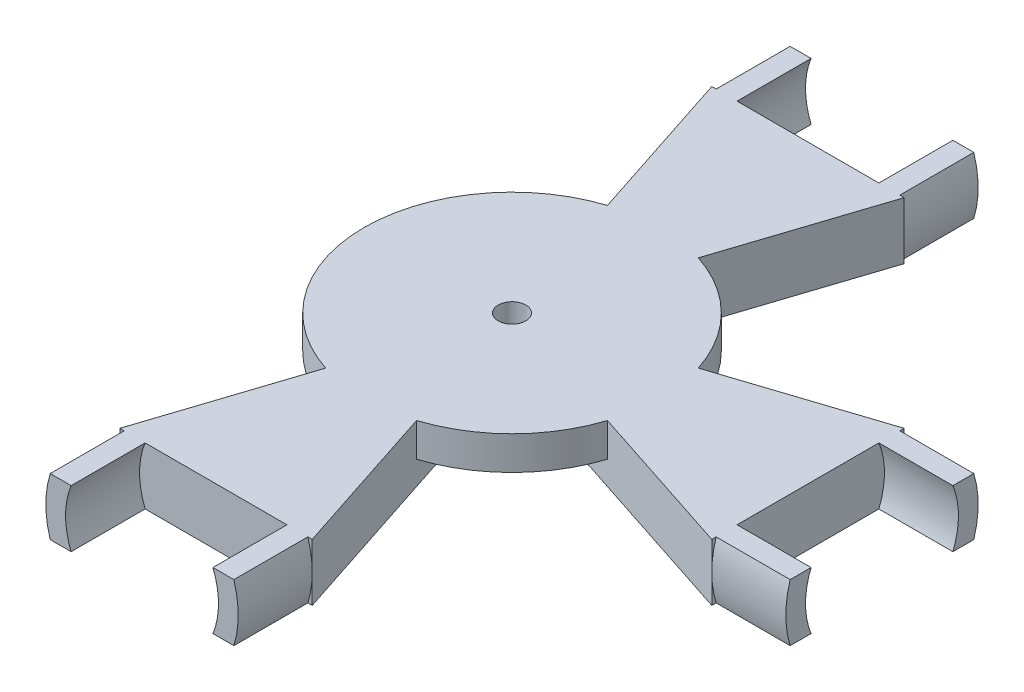
from build123d import *

# Parameters (mm, degrees)
SKETCH1_R                 = 6.35
BOSS_EXTRUDE1_DEPTH       = 5.4
HORN_START                = -2.5
HORN_DEPTH                = 2.5
SKETCH4_R                 = 1.4
CUT_EXTRUDE1_DEPTH        = 21.913032
SKETCH5_R                 = 0.5
CUT_EXTRUDE2_DEPTH        = 21.913032
LPATTERN1_COUNT           = 4
LPATTERN1_PITCH           = 3
MIRROR1_COPY_1_SKETCH_R   = 0.5
MIRROR1_COPY_1_DEPTH      = 21.913032
MIRROR1_COPY_2_SKETCH_R   = 0.5
MIRROR1_COPY_2_DEPTH      = 21.913032
MIRROR1_COPY_3_SKETCH_R   = 0.5
MIRROR1_COPY_3_DEPTH      = 21.913032
CUT_EXTRUDE4_DEPTH        = 3
CIRPATTERN2_COUNT         = 26
SKETCH9_R                 = 2.6
CUT_EXTRUDE5_DEPTH        = 3
SKETCH10_R                = 6.35
SKETCH10_R_2              = 4.25
CUT_EXTRUDE6_DEPTH        = 2.9
BOSS_EXTRUDE5_DEPTH       = 0.5
CIRPATTERN3_COUNT         = 4
SKETCH12_R                = 4.375
CUT_EXTRUDE7_DEPTH        = 1
SKETCH13_R                = 3.375
SKETCH13_R_2              = 2.875
BOSS_EXTRUDE6_DEPTH       = 1
SKETCH14_R                = 3.375
SKETCH14_R_2              = 2.875
BOSS_EXTRUDE7_DEPTH       = 0.35
BOSS_EXTRUDE8_DEPTH       = 7.5
BOSS_EXTRUDE8_2_DEPTH     = 7.5
BOSS_EXTRUDE9_DEPTH       = 2.9
BOSS_EXTRUDE9_DEPTH_BACK  = 2.9
BOSS_EXTRUDE10_START      = 7.5
BOSS_EXTRUDE10_DEPTH      = 7.5
BOSS_EXTRUDE11_DEPTH      = 7.5
BOSS_EXTRUDE12_DEPTH      = 0.4
BOSS_EXTRUDE12_DEPTH_BACK = 3
SKETCH22_R                = 15
SKETCH22_R_2              = 4.375
SKETCH23_R                = 5.25
SKETCH23_R_2              = 4.25
BOSS_EXTRUDE13_DEPTH      = 2.4
BOSS_EXTRUDE14_START      = 1.4
SKETCH24_R                = 7.155561
SKETCH24_R_2              = 1.4
BOSS_EXTRUDE14_DEPTH      = 1.4


with BuildPart() as part:
    # Sketch1 → Boss-Extrude1 (new body)
    with BuildSketch(Plane(origin=(0, 0, 0), x_dir=(1, 0, 0), z_dir=(0, 1, 0))):
        with Locations(Location((0, 0, 0), (0, 0, 90))):
            Circle(SKETCH1_R)
    extrude(amount=BOSS_EXTRUDE1_DEPTH)

    # Sketch2 → horn (add)
    with BuildSketch(Plane(origin=(0, 5.4, 0), x_dir=(1, 0, 0), z_dir=(0, 1, 0)).offset(HORN_START)):
        with BuildLine():
            Line((-2.609741, 16.990168), (-4.891613, 4.049028))
            ThreePointArc((-4.891613, 4.049028), (0, 6.35), (4.891613, 4.049028))
            Line((4.891613, 4.049028), (2.609741, 16.990168))
            ThreePointArc((2.609741, 16.990168), (0, 19.18), (-2.609741, 16.990168))
        make_face()
    horn = extrude(amount=HORN_DEPTH)

    # Sketch4 → Cut-Extrude1 (cut, through all)
    with BuildSketch(Plane(origin=(0, 5.4, 0), x_dir=(-1, 0, 0), z_dir=(0, -1, 0))):
        with Locations(Location((0, 0, 0), (0, 0, 270))):
            Circle(SKETCH4_R)
    extrude(amount=CUT_EXTRUDE1_DEPTH, mode=Mode.SUBTRACT)

    # Sketch5 → Cut-Extrude2 (cut, through all)
    with BuildSketch(Plane(origin=(0, 0, 0), x_dir=(-1, 0, 0), z_dir=(0, -1, 0))):
        with Locations(Location((0, 16.53, 0), (0, 0, 90))):
            Circle(SKETCH5_R)
    cut_extrude2 = extrude(amount=-CUT_EXTRUDE2_DEPTH, mode=Mode.SUBTRACT)

    # LPattern1: Cut-Extrude2 ×4
    with Locations(*[(0, 0, i * LPATTERN1_PITCH) for i in range(1, LPATTERN1_COUNT)]):
        add(cut_extrude2, mode=Mode.SUBTRACT)

    # Mirror1: horn, Cut-Extrude2 across plane
    add(horn.mirror(Plane.XY))
    add(cut_extrude2.mirror(Plane.XY), mode=Mode.SUBTRACT)

    # Mirror1 copy 1 sketch → Mirror1 copy 1 (cut, through all)
    with BuildSketch(Plane(origin=(0, 0, -3), x_dir=(-1, 0, 0), z_dir=(0, -1, 0))):
        with Locations((0, -16.53)):
            Circle(MIRROR1_COPY_1_SKETCH_R)
    extrude(amount=-MIRROR1_COPY_1_DEPTH, mode=Mode.SUBTRACT)

    # Mirror1 copy 2 sketch → Mirror1 copy 2 (cut, through all)
    with BuildSketch(Plane(origin=(0, 0, -6), x_dir=(-1, 0, 0), z_dir=(0, -1, 0))):
        with Locations((0, -16.53)):
            Circle(MIRROR1_COPY_2_SKETCH_R)
    extrude(amount=-MIRROR1_COPY_2_DEPTH, mode=Mode.SUBTRACT)

    # Mirror1 copy 3 sketch → Mirror1 copy 3 (cut, through all)
    with BuildSketch(Plane(origin=(0, 0, -9), x_dir=(-1, 0, 0), z_dir=(0, -1, 0))):
        with Locations((0, -16.53)):
            Circle(MIRROR1_COPY_3_SKETCH_R)
    extrude(amount=-MIRROR1_COPY_3_DEPTH, mode=Mode.SUBTRACT)

    # Sketch8 → Cut-Extrude4 (cut)
    with BuildSketch(Plane(origin=(0, 0, 0), x_dir=(-1, 0, 0), z_dir=(0, -1, 0))):
        with BuildLine():
            Line((0, -2.9), (0.262913, -2.586673))
            ThreePointArc((0.262913, -2.586673), (0, -2.6), (-0.262913, -2.586673))
            Line((-0.262913, -2.586673), (0, -2.9))
        make_face()
    cut_extrude4 = extrude(amount=-CUT_EXTRUDE4_DEPTH, mode=Mode.SUBTRACT)

    # CirPattern2: Cut-Extrude4 ×26 about axis
    cirpattern2_axis = Axis((0, 0, 0), (0, 1, 0))
    for i in range(1, CIRPATTERN2_COUNT):
        add(cut_extrude4.rotate(cirpattern2_axis, i * 360 / CIRPATTERN2_COUNT), mode=Mode.SUBTRACT)

    # Sketch9 → Cut-Extrude5 (cut)
    with BuildSketch(Plane(origin=(0, 0, 0), x_dir=(-1, 0, 0), z_dir=(0, -1, 0))):
        Circle(SKETCH9_R)
    extrude(amount=-CUT_EXTRUDE5_DEPTH, mode=Mode.SUBTRACT)

    # Sketch10 → Cut-Extrude6 (cut)
    with BuildSketch(Plane(origin=(0, 0, 0), x_dir=(-1, 0, 0), z_dir=(0, -1, 0))):
        Circle(SKETCH10_R)
        with Locations(Location((0, 0, 0), (0, 0, 90))):
            Circle(SKETCH10_R_2, mode=Mode.SUBTRACT)
    extrude(amount=-CUT_EXTRUDE6_DEPTH, mode=Mode.SUBTRACT)

    # Sketch11 → Boss-Extrude5 (add, symmetric)
    with BuildSketch(Plane.XY):
        Polygon((4.21, 0.99), (5.81268, 2.9), (4.21, 2.9), (4.16, 2.9), (4.16, 0.99), align=None)
    boss_extrude5 = extrude(amount=BOSS_EXTRUDE5_DEPTH, both=True)

    # CirPattern3: Boss-Extrude5 ×4 about axis
    cirpattern3_axis = Axis((0, 0, 0), (0, 1, 0))
    for i in range(1, CIRPATTERN3_COUNT):
        add(boss_extrude5.rotate(cirpattern3_axis, i * 360 / CIRPATTERN3_COUNT))

    # Sketch12 → Cut-Extrude7 (cut)
    with BuildSketch(Plane(origin=(0, 5.4, 0), x_dir=(1, 0, 0), z_dir=(0, 1, 0))):
        with Locations(Location((0, 0, 0), (0, 0, 270))):
            Circle(SKETCH12_R)
    extrude(amount=-CUT_EXTRUDE7_DEPTH, mode=Mode.SUBTRACT)

    # Sketch13 → Boss-Extrude6 (add)
    with BuildSketch(Plane(origin=(0, 4.4, 0), x_dir=(1, 0, 0), z_dir=(0, 1, 0))):
        with Locations(Location((0, 0, 0), (0, 0, 270))):
            Circle(SKETCH13_R)
        with Locations(Location((0, 0, 0), (0, 0, 270))):
            Circle(SKETCH13_R_2, mode=Mode.SUBTRACT)
    extrude(amount=BOSS_EXTRUDE6_DEPTH)

    # Sketch14 → Boss-Extrude7 (add)
    with BuildSketch(Plane(origin=(0, 5.4, 0), x_dir=(1, 0, 0), z_dir=(0, 1, 0))):
        with Locations(Location((0, 0, 0), (0, 0, 270))):
            Circle(SKETCH14_R)
        with Locations(Location((0, 0, 0), (0, 0, 270))):
            Circle(SKETCH14_R_2, mode=Mode.SUBTRACT)
    extrude(amount=BOSS_EXTRUDE7_DEPTH)



with BuildPart() as body_2:
    # Sketch16 → Boss-Extrude8 (new body)
    with BuildSketch(Plane.XY.offset(30)):
        with BuildLine():
            Line((-7.186967, 0), (-9.308732, 0))
            ThreePointArc((-9.308732, 0), (-9.75, 2.9), (-9.308732, 5.8))
            Line((-9.308732, 5.8), (-7.186967, 5.8))
            ThreePointArc((-7.186967, 5.8), (-7.75, 2.9), (-7.186967, 0))
        make_face()
    extrude(amount=BOSS_EXTRUDE8_DEPTH)


with BuildPart() as body_3:
    # Sketch16 → Boss-Extrude8 2 (new body)
    with BuildSketch(Plane.XY.offset(30)):
        with BuildLine():
            Line((7.186967, 0), (9.308732, 0))
            ThreePointArc((9.308732, 0), (9.75, 2.9), (9.308732, 5.8))
            Line((9.308732, 5.8), (7.186967, 5.8))
            ThreePointArc((7.186967, 5.8), (7.75, 2.9), (7.186967, 0))
        make_face()
    extrude(amount=BOSS_EXTRUDE8_2_DEPTH)


with BuildPart() as part_1:
    add(part.part)

    add(body_2.part)  # Boss-Extrude9 merges body 2

    add(body_3.part)  # Boss-Extrude9 merges body 3
    # Sketch18 → Boss-Extrude9 (add, two sides: drawn at the far end of the back side and taken through both)
    with BuildSketch(Plane.XZ.offset(-2.9).offset(-BOSS_EXTRUDE9_DEPTH_BACK)):
        with BuildLine():
            Line((-1.259498, 4.059084), (-9.75, 30))
            Line((-9.75, 30), (9.75, 30))
            Line((9.75, 30), (1.259498, 4.059084))
            ThreePointArc((1.259498, 4.059084), (0, 4.25), (-1.259498, 4.059084))
        make_face()
        with BuildLine():
            Line((4.059084, 1.259498), (30, 9.75))
            Line((30, 9.75), (30, -9.75))
            Line((30, -9.75), (4.059084, -1.259498))
            ThreePointArc((4.059084, -1.259498), (4.25, 0), (4.059084, 1.259498))
        make_face()
        with BuildLine():
            Line((1.259498, -4.059084), (9.75, -30))
            Line((9.75, -30), (-9.75, -30))
            Line((-9.75, -30), (-1.259498, -4.059084))
            ThreePointArc((-1.259498, -4.059084), (0, -4.25), (1.259498, -4.059084))
        make_face()
    extrude(amount=BOSS_EXTRUDE9_DEPTH + BOSS_EXTRUDE9_DEPTH_BACK)

    # Sketch19 → Boss-Extrude10 (add)
    with BuildSketch(Plane(origin=(0, 0, -30), x_dir=(-1, 0, 0), z_dir=(0, 0, -1)).offset(BOSS_EXTRUDE10_START)):
        with BuildLine():
            Line((-9.308732, 5.8), (-7.186967, 5.8))
            ThreePointArc((-7.186967, 5.8), (-7.75, 2.9), (-7.186967, 0))
            Line((-7.186967, 0), (-9.308732, 0))
            ThreePointArc((-9.308732, 0), (-9.75, 2.9), (-9.308732, 5.8))
        make_face()
        with BuildLine():
            Line((7.186967, 5.8), (9.308732, 5.8))
            ThreePointArc((9.308732, 5.8), (9.75, 2.9), (9.308732, 0))
            Line((9.308732, 0), (7.186967, 0))
            ThreePointArc((7.186967, 0), (7.75, 2.9), (7.186967, 5.8))
        make_face()
    extrude(amount=-BOSS_EXTRUDE10_DEPTH)

    # Sketch21 → Boss-Extrude11 (add)
    with BuildSketch(Plane(origin=(30, 0, 0), x_dir=(0, 0, -1), z_dir=(1, 0, 0))):
        with BuildLine():
            Line((7.186967, 5.8), (9.308732, 5.8))
            ThreePointArc((9.308732, 5.8), (9.75, 2.9), (9.308732, 0))
            Line((9.308732, 0), (7.186967, 0))
            ThreePointArc((7.186967, 0), (7.75, 2.9), (7.186967, 5.8))
        make_face()
        with BuildLine():
            Line((-7.186967, 5.8), (-9.308732, 5.8))
            ThreePointArc((-9.308732, 5.8), (-9.75, 2.9), (-9.308732, 0))
            Line((-9.308732, 0), (-7.186967, 0))
            ThreePointArc((-7.186967, 0), (-7.75, 2.9), (-7.186967, 5.8))
        make_face()
    extrude(amount=BOSS_EXTRUDE11_DEPTH)

    # Sketch22 → Boss-Extrude12 (add, two sides: drawn at the far end of the back side and taken through both)
    with BuildSketch(Plane(origin=(0, 5.4, 0), x_dir=(1, 0, 0), z_dir=(0, 1, 0)).offset(-BOSS_EXTRUDE12_DEPTH_BACK)):
        Circle(SKETCH22_R)
        Circle(SKETCH22_R_2, mode=Mode.SUBTRACT)
    extrude(amount=BOSS_EXTRUDE12_DEPTH + BOSS_EXTRUDE12_DEPTH_BACK)

    # Sketch23 → Boss-Extrude13 (add)
    with BuildSketch(Plane.XZ.offset(-2.4)):
        Circle(SKETCH23_R)
        Circle(SKETCH23_R_2, mode=Mode.SUBTRACT)
    extrude(amount=BOSS_EXTRUDE13_DEPTH)

    # Sketch24 → Boss-Extrude14 (add)
    with BuildSketch(Plane(origin=(0, 4.4, 0), x_dir=(1, 0, 0), z_dir=(0, 1, 0)).offset(BOSS_EXTRUDE14_START)):
        Circle(SKETCH24_R)
        with Locations(Location((0, 0, 0), (0, 0, 270))):
            Circle(SKETCH24_R_2, mode=Mode.SUBTRACT)
    extrude(amount=-BOSS_EXTRUDE14_DEPTH)


solid = part_1.part
